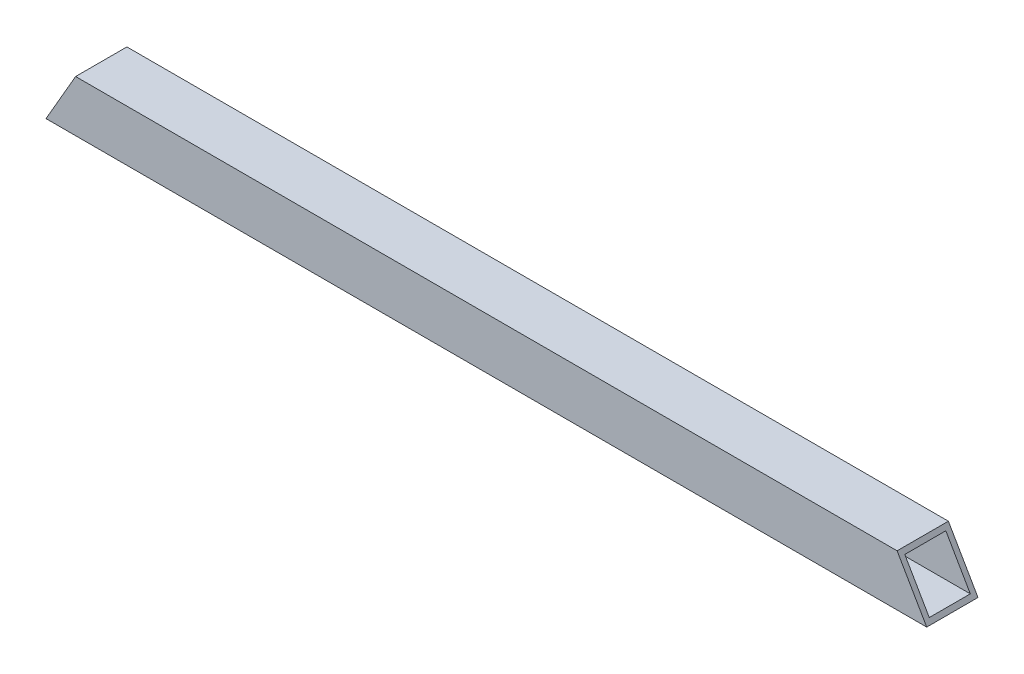
from build123d import *

# Parameters (mm, degrees)
BOSS_EXTRUDE1_DEPTH     = 20
CUT_EXTRUDE1_DEPTH      = 286.306420625
CUT_EXTRUDE1_DEPTH_BACK = 286.306420625
SKETCH3_W               = 16
SKETCH3_H               = 16.536122988


with BuildPart() as part:
    # Sketch1 → Boss-Extrude1 (new body)
    with BuildSketch(Plane.XY):
        Polygon((-48.421052632, 24.605263158), (271.988947368, 24.605263158), (283.538947368, 4.605263158), (-59.971052632, 4.605263158), align=None)
    extrude(amount=BOSS_EXTRUDE1_DEPTH)

    # Sketch3 → Cut-Extrude1 (cut, two sides: drawn at the far end of the back side and taken through both)
    with BuildSketch(Plane(origin=(0, 0, 0), x_dir=(0, 0, -1), z_dir=(1, 0, 0)).offset(-CUT_EXTRUDE1_DEPTH_BACK)):
        with Locations((-10, 14.605263158)):
            Rectangle(SKETCH3_W, SKETCH3_H)
    extrude(amount=CUT_EXTRUDE1_DEPTH + CUT_EXTRUDE1_DEPTH_BACK, mode=Mode.SUBTRACT)


solid = part.part
